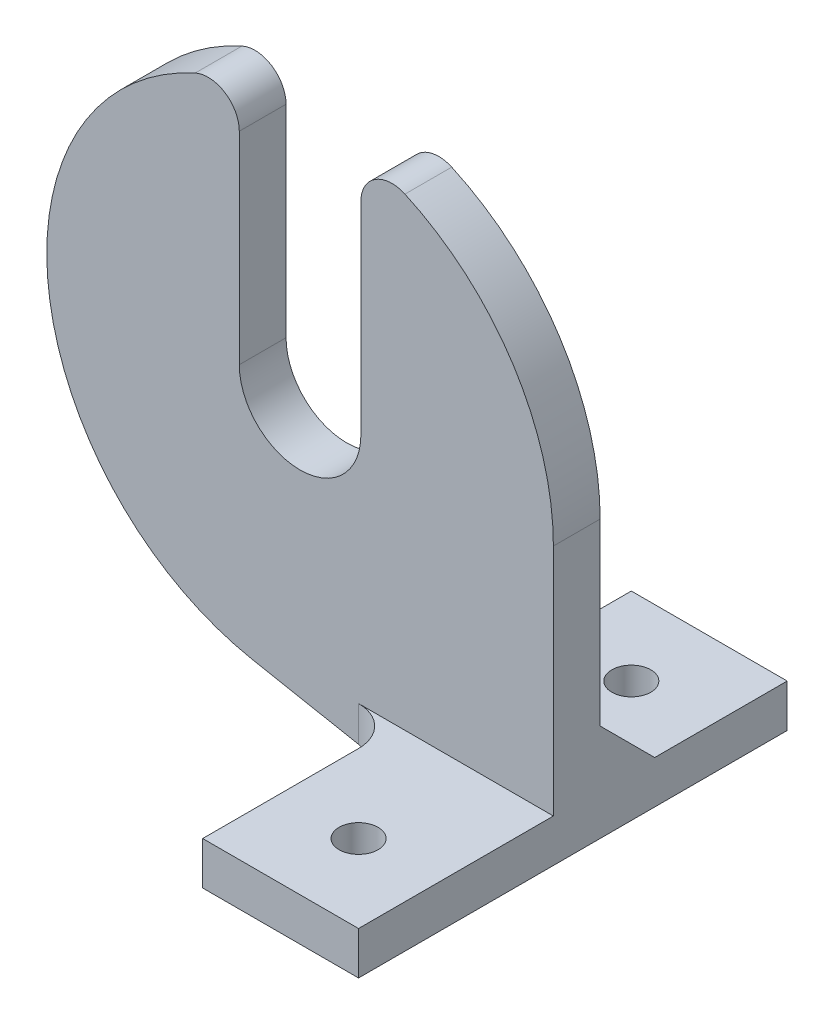
from build123d import *

# Parameters (mm, degrees)
BOSS_EXTRUDE1_DEPTH      = 7.62
BOSS_EXTRUDE2_DEPTH      = 31.75
BOSS_EXTRUDE2_DEPTH_BACK = 38.1
SKETCH2_W                = 25.4
SKETCH2_H                = 6.985
BOSS_EXTRUDE3_START      = -7.62
BOSS_EXTRUDE3_DEPTH      = 7.62
SKETCH4_R                = 3.175
CUT_EXTRUDE1_DEPTH       = 7.62
CHAMFER1_SIZE            = 8.89
FILLET1_R                = 6.35
FILLET2_R                = 5.08


with BuildPart() as part:
    # Sketch1 → Boss-Extrude1 (new body)
    with BuildSketch(Plane.XY):
        with BuildLine():
            Line((41.275, -41.275), (0, -41.275))
            ThreePointArc((0, -41.275), (-40.972302797, -4.989592018), (-9.906, 40.068650951))
            Line((-9.906, 40.068650951), (-9.906, 0))
            ThreePointArc((-9.906, 0), (0, -9.906), (9.906, 0))
            Line((9.906, 0), (9.906, 40.068650951))
            ThreePointArc((9.906, 40.068650951), (32.4999675, 25.443618797), (41.275, 0))
            Line((41.275, 0), (41.275, -41.275))
        make_face()
    extrude(amount=BOSS_EXTRUDE1_DEPTH)

    # Sketch2 → Boss-Extrude2 (add, two sides: drawn at the far end of the back side and taken through both)
    with BuildSketch(Plane.XY.offset(7.62).offset(-BOSS_EXTRUDE2_DEPTH_BACK)):
        with Locations((28.575, -41.5925)):
            Rectangle(SKETCH2_W, SKETCH2_H)
    extrude(amount=BOSS_EXTRUDE2_DEPTH + BOSS_EXTRUDE2_DEPTH_BACK)

    # Sketch3 → Boss-Extrude3 (add)
    with BuildSketch(Plane.XY.offset(7.62).offset(BOSS_EXTRUDE3_START)):
        with BuildLine():
            Line((15.875, -45.085), (-7.79603534, -40.532054697))
            ThreePointArc((-7.79603534, -40.532054697), (-3.915677934, -41.088843879), (0, -41.275))
            Line((0, -41.275), (15.875, -41.275))
            Line((15.875, -41.275), (15.875, -45.085))
        make_face()
    extrude(amount=BOSS_EXTRUDE3_DEPTH)

    # Sketch4 → Cut-Extrude1 (cut)
    with BuildSketch(Plane(origin=(0, -38.1, 0), x_dir=(1, 0, 0), z_dir=(0, 1, 0))):
        with Locations(Location((28.575, -26.67, 0), (0, 0, 270))):
            Circle(SKETCH4_R)
        with Locations(Location((28.575, 17.78, 0), (0, 0, 270))):
            Circle(SKETCH4_R)
    extrude(amount=-CUT_EXTRUDE1_DEPTH, mode=Mode.SUBTRACT)

    # Chamfer1
    chamfer1_edges = [part.edges().sort_by_distance(p)[0] for p in [
        (28.575, -38.1, 0),
    ]]
    chamfer(chamfer1_edges, length=CHAMFER1_SIZE)

    # Fillet1
    fillet1_edges = [part.edges().sort_by_distance(p)[0] for p in [
        (15.875, -37.1475, 0),
        (15.875, -41.5925, 7.62),
    ]]
    fillet(fillet1_edges, radius=FILLET1_R)

    # Fillet2
    fillet2_edges = [part.edges().sort_by_distance(p)[0] for p in [
        (9.906, 40.068650951, 3.81),
        (-9.906, 40.068650951, 3.81),
    ]]
    fillet(fillet2_edges, radius=FILLET2_R)


solid = part.part
